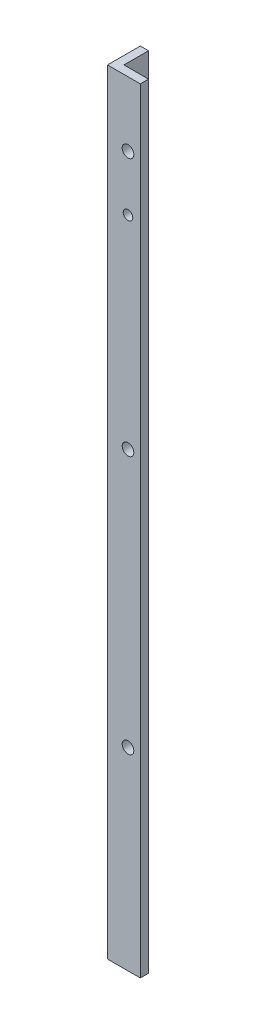
from build123d import *

# Parameters (mm, degrees)
BOSS_EXTRUDE1_DEPTH = 300
SKETCH3_R           = 2.25
CUT_EXTRUDE1_DEPTH  = 300
SKETCH6_R           = 2.25
CUT_EXTRUDE2_DEPTH  = 10
SKETCH7_R           = 1.85
CUT_EXTRUDE3_DEPTH  = 301.537152445


with BuildPart() as part:
    # Sketch1 → Boss-Extrude1 (new body)
    with BuildSketch(Plane(origin=(0, 0, 0), x_dir=(1, 0, 0), z_dir=(0, 1, 0))):
        Polygon((0, 0), (12.7, 0), (12.7, 3.18), (3.18, 3.18), (3.18, 12.7), (0, 12.7), align=None)
    extrude(amount=BOSS_EXTRUDE1_DEPTH)

    # Sketch3 → Cut-Extrude1 (cut)
    with BuildSketch(Plane(origin=(0, 0, -3.18), x_dir=(-1, 0, 0), z_dir=(0, 0, -1))):
        with Locations((-7.94, 275)):
            Circle(SKETCH3_R)
        with Locations((-7.94, 175)):
            Circle(SKETCH3_R)
        with Locations((-7.94, 75)):
            Circle(SKETCH3_R)
    extrude(amount=-CUT_EXTRUDE1_DEPTH, mode=Mode.SUBTRACT)

    # Sketch6 → Cut-Extrude2 (cut)
    with BuildSketch(Plane(origin=(3.18, 0, 0), x_dir=(0, 0, -1), z_dir=(1, 0, 0))):
        with Locations((7.94, 225)):
            Circle(SKETCH6_R)
        with Locations((7.94, 125)):
            Circle(SKETCH6_R)
        with Locations((7.94, 25)):
            Circle(SKETCH6_R)
    extrude(amount=-CUT_EXTRUDE2_DEPTH, mode=Mode.SUBTRACT)

    # Sketch7 → Cut-Extrude3 (cut, through all)
    with BuildSketch(Plane.XY):
        with Locations((7.94, 253.6)):
            Circle(SKETCH7_R)
    extrude(amount=-CUT_EXTRUDE3_DEPTH, mode=Mode.SUBTRACT)


solid = part.part
